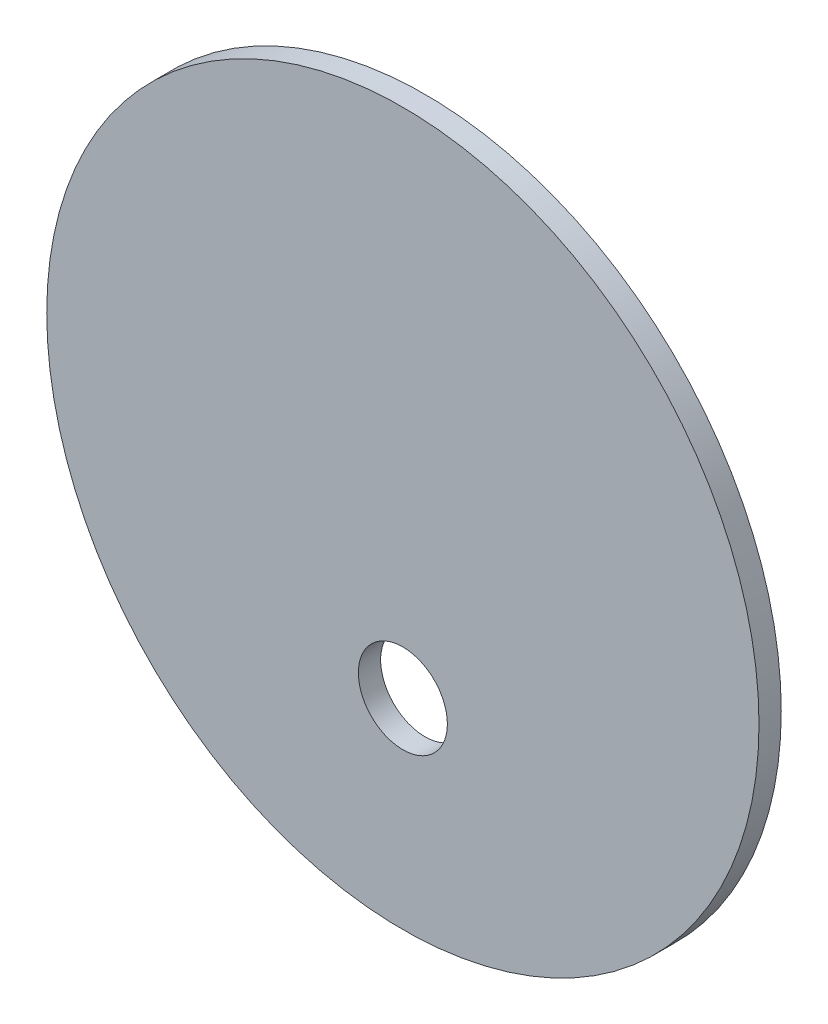
from build123d import *

# Parameters (mm, degrees)
SKETCH1_R           = 80
BOSS_EXTRUDE1_DEPTH = 5
SKETCH2_R           = 10
CUT_EXTRUDE2_DEPTH  = 20


with BuildPart() as part:
    # Sketch1 → Boss-Extrude1 (new body)
    with BuildSketch(Plane.XY):
        Circle(SKETCH1_R)
    extrude(amount=BOSS_EXTRUDE1_DEPTH)

    # Sketch2 → Cut-Extrude2 (cut)
    with BuildSketch(Plane.XY.offset(5)):
        with Locations((0, -35)):
            Circle(SKETCH2_R)
    extrude(amount=-CUT_EXTRUDE2_DEPTH, mode=Mode.SUBTRACT)


solid = part.part
